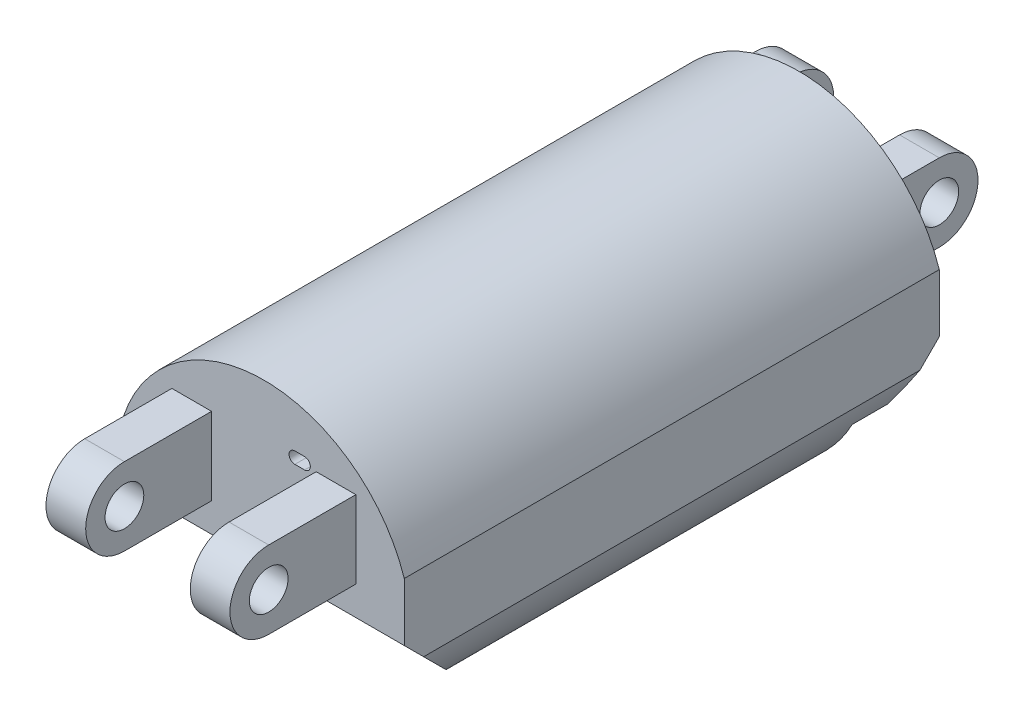
from build123d import *

# Parameters (mm, degrees)
BOSS_EXTRUDE1_DEPTH      = 17.541875
CUT_EXTRUDE1_DEPTH       = 29.014877472
CUT_EXTRUDE2_DEPTH       = 42.327781156
CUT_EXTRUDE2_DEPTH_BACK  = 42.327781156
SKETCH4_R                = 1.27
BOSS_EXTRUDE2_DEPTH      = 0.635
SKETCH5_R                = 1.27
BOSS_EXTRUDE3_DEPTH      = 1.332294919
MIRROR2_COPY_1_SKETCH_R  = 1.27
MIRROR2_COPY_1_DEPTH     = 0.635
MIRROR2_COPY_2_SKETCH_R  = 1.27
MIRROR2_COPY_2_DEPTH     = 1.332294919
SKETCH10_R               = 1.27
BOSS_EXTRUDE6_DEPTH      = 2.602294919
BOSS_EXTRUDE7_START      = -2.602294919
BOSS_EXTRUDE7_DEPTH      = 2.602294919
SKETCH11_R               = 1.27
CUT_EXTRUDE5_DEPTH       = 12.065
SKETCH20_W               = 2.54
SKETCH20_H               = 12.7
CUT_EXTRUDE9_DEPTH       = 5.08
CUT_EXTRUDE10_DEPTH      = 10.16
CUT_EXTRUDE10_DEPTH_BACK = 15.875
FILLET1_R                = 0.635
SKETCH22_W               = 0.284935898
SKETCH22_H               = 2.320192308
CUT_EXTRUDE11_DEPTH      = 1
CUT_EXTRUDE12_DEPTH      = 17.78


with BuildPart() as part:
    # Sketch1 → Boss-Extrude1 (new, symmetric)
    with BuildSketch(Plane.XY):
        with BuildLine():
            Line((0, 0), (0, 5.08))
            ThreePointArc((0, 5.08), (9.2075, 11.7475), (18.415, 5.08))
            Line((18.415, 5.08), (18.415, 0))
            ThreePointArc((18.415, 0), (9.2075, -6.6675), (0, 0))
        make_face()
    extrude(amount=BOSS_EXTRUDE1_DEPTH, both=True)

    # Sketch2 → Cut-Extrude1 (cut, through all)
    with BuildSketch(Plane(origin=(0, 0, 0), x_dir=(0, 0, -1), z_dir=(1, 0, 0))):
        Polygon((-17.541875, 1.27), (-17.541875, -6.6675), (-9.604375, -6.6675), align=None)
        Polygon((17.541875, -6.6675), (9.604375, -6.6675), (17.541875, 1.27), align=None)
    extrude(amount=CUT_EXTRUDE1_DEPTH, mode=Mode.SUBTRACT)

    # Sketch3 → Cut-Extrude2 (cut, two sides: drawn at the far end of the back side and taken through both)
    with BuildSketch(Plane.XY.offset(17.541875).offset(-CUT_EXTRUDE2_DEPTH_BACK)):
        with BuildLine():
            ThreePointArc((6.08942364, -4.798981149), (9.2075, -5.3975), (12.32557636, -4.798981149))
            ThreePointArc((12.32557636, -4.798981149), (9.2075, -2.2225), (6.08942364, -4.798981149))
        make_face()
    extrude(amount=CUT_EXTRUDE2_DEPTH + CUT_EXTRUDE2_DEPTH_BACK, mode=Mode.SUBTRACT)

    # Sketch4 → Boss-Extrude2 (add, symmetric)
    with BuildSketch(Plane(origin=(14.605, 0, 0), x_dir=(0, 0, -1), z_dir=(1, 0, 0))):
        with BuildLine():
            Line((-17.541875, 8.255), (-20.716875, 8.255))
            ThreePointArc((-20.716875, 8.255), (-23.256875, 5.715), (-20.716875, 3.175))
            Line((-20.716875, 3.175), (-17.541875, 3.175))
            Line((-17.541875, 3.175), (-17.541875, 8.255))
        make_face()
        with Locations((-20.716875, 5.715)):
            Circle(SKETCH4_R, mode=Mode.SUBTRACT)
    boss_extrude2 = extrude(amount=BOSS_EXTRUDE2_DEPTH, both=True)

    # Sketch5 → Boss-Extrude3 (add)
    with BuildSketch(Plane.ZY.offset(-13.97)):
        with BuildLine():
            Line((17.541875, 8.255), (17.541875, 3.175))
            Line((17.541875, 3.175), (20.716875, 3.175))
            ThreePointArc((20.716875, 3.175), (23.256875, 5.715), (20.716875, 8.255))
            Line((20.716875, 8.255), (17.541875, 8.255))
        make_face()
        with Locations((20.716875, 5.715)):
            Circle(SKETCH5_R, mode=Mode.SUBTRACT)
    boss_extrude3 = extrude(amount=BOSS_EXTRUDE3_DEPTH)

    # Mirror1: Boss-Extrude2, Boss-Extrude3 across plane
    add(boss_extrude2.mirror(Plane(origin=(9.2075, 0, 0), x_dir=(0, 0, 1), z_dir=(1, 0, 0))))
    add(boss_extrude3.mirror(Plane(origin=(9.2075, 0, 0), x_dir=(0, 0, 1), z_dir=(1, 0, 0))))

    # Mirror2: Boss-Extrude2, Boss-Extrude3 across plane
    add(boss_extrude2.mirror(Plane.XY))
    add(boss_extrude3.mirror(Plane.XY))

    # Mirror2 copy 1 sketch → Mirror2 copy 1 (add, symmetric)
    with BuildSketch(Plane.ZY.offset(-3.81)):
        with BuildLine():
            Line((-17.541875, 8.255), (-20.716875, 8.255))
            ThreePointArc((-20.716875, 8.255), (-23.256875, 5.715), (-20.716875, 3.175))
            Line((-20.716875, 3.175), (-17.541875, 3.175))
            Line((-17.541875, 3.175), (-17.541875, 8.255))
        make_face()
        with Locations((-20.716875, 5.715)):
            Circle(MIRROR2_COPY_1_SKETCH_R, mode=Mode.SUBTRACT)
    extrude(amount=MIRROR2_COPY_1_DEPTH, both=True)

    # Mirror2 copy 2 sketch → Mirror2 copy 2 (add)
    with BuildSketch(Plane(origin=(4.445, 0, 0), x_dir=(0, 0, -1), z_dir=(1, 0, 0))):
        with BuildLine():
            Line((17.541875, 8.255), (17.541875, 3.175))
            Line((17.541875, 3.175), (20.716875, 3.175))
            ThreePointArc((20.716875, 3.175), (23.256875, 5.715), (20.716875, 8.255))
            Line((20.716875, 8.255), (17.541875, 8.255))
        make_face()
        with Locations((20.716875, 5.715)):
            Circle(MIRROR2_COPY_2_SKETCH_R, mode=Mode.SUBTRACT)
    extrude(amount=MIRROR2_COPY_2_DEPTH)

    # Sketch10 → Boss-Extrude6 (add)
    with BuildSketch(Plane(origin=(15.24, 0, 0), x_dir=(0, 0, -1), z_dir=(1, 0, 0))):
        with BuildLine():
            Line((-17.541875, 8.255), (-23.256875, 8.255))
            ThreePointArc((-23.256875, 8.255), (-25.796875, 5.715), (-23.256875, 3.175))
            Line((-23.256875, 3.175), (-17.541875, 3.175))
            Line((-17.541875, 3.175), (-17.541875, 8.255))
        make_face()
        with Locations((-23.256875, 5.715)):
            Circle(SKETCH10_R, mode=Mode.SUBTRACT)
    extrude(amount=-BOSS_EXTRUDE6_DEPTH)

    # Sketch12 → Boss-Extrude7 (add)
    with BuildSketch(Plane.ZY.offset(-3.175).offset(BOSS_EXTRUDE7_START)):
        with BuildLine():
            Line((17.541875, 8.255), (23.256875, 8.255))
            ThreePointArc((23.256875, 8.255), (25.796875, 5.715), (23.256875, 3.175))
            Line((23.256875, 3.175), (17.541875, 3.175))
            Line((17.541875, 3.175), (17.541875, 8.255))
        make_face()
    extrude(amount=BOSS_EXTRUDE7_DEPTH)

    # Sketch11 → Cut-Extrude5 (cut)
    with BuildSketch(Plane(origin=(15.24, 0, 0), x_dir=(0, 0, -1), z_dir=(1, 0, 0))):
        with Locations((-23.256875, 5.715)):
            Circle(SKETCH11_R)
    extrude(amount=-CUT_EXTRUDE5_DEPTH, mode=Mode.SUBTRACT)

    # Sketch20 → Cut-Extrude9 (cut)
    with BuildSketch(Plane(origin=(0, 0, -17.541875), x_dir=(-1, 0, 0), z_dir=(0, 0, -1))):
        with Locations((-16.51, -0.635)):
            Rectangle(SKETCH20_W, SKETCH20_H)
        with Locations((-1.905, -0.635)):
            Rectangle(SKETCH20_W, SKETCH20_H)
    extrude(amount=-CUT_EXTRUDE9_DEPTH, mode=Mode.SUBTRACT)

    # Sketch21 → Cut-Extrude10 (cut, two sides: drawn at the far end of the back side and taken through both)
    with BuildSketch(Plane(origin=(0, 0, -17.541875), x_dir=(-1, 0, 0), z_dir=(0, 0, -1)).offset(-CUT_EXTRUDE10_DEPTH_BACK)):
        with BuildLine():
            Line((-7.1755, 7.7978), (-6.5405, 7.7978))
            Line((-6.5405, 7.7978), (-6.5405, 8.5598))
            Line((-6.5405, 8.5598), (-7.1755, 8.5598))
            ThreePointArc((-7.1755, 8.5598), (-7.5565, 8.1788), (-7.1755, 7.7978))
        make_face()
        with BuildLine():
            Line((-6.5405, 8.5598), (-6.5405, 7.7978))
            ThreePointArc((-6.5405, 7.7978), (-6.1595, 8.1788), (-6.5405, 8.5598))
        make_face()
    extrude(amount=CUT_EXTRUDE10_DEPTH + CUT_EXTRUDE10_DEPTH_BACK, mode=Mode.SUBTRACT)

    # Fillet1
    fillet1_edges = [part.edges().sort_by_distance(p)[0] for p in [
        (16.51, 5.715, -17.541875),
        (1.905, 5.715, -17.541875),
    ]]
    fillet(fillet1_edges, radius=FILLET1_R)

    # Sketch22 → Cut-Extrude11 (cut)
    # profile 1 of 9: a face of its own
    with BuildSketch(Plane.ZY):
        with BuildLine():
            Line((-8.211688554, 3.896834591), (-7.589027296, 3.896834591))
            add(Edge.make_bspline(
                [(-7.589027296, 3.896834591), (-7.546200259, 3.896787514), (-7.464141756, 3.896697312), (-7.34647167, 3.893962506), (-7.239601413, 3.890309721), (-7.143761425, 3.885246147), (-7.058656821, 3.879262097), (-6.9846727, 3.870869176), (-6.921227531, 3.862105908), (-6.883212394, 3.853196489), (-6.865875252, 3.849133269)],
                knots=[0, 0, 0, 0, 1.415646017, 2.712440637, 3.8905458, 4.950247383, 5.884950622, 6.709939814, 7.411656543, 8, 8, 8, 8], degree=3))
            add(Edge.make_bspline(
                [(-6.865875252, 3.849133269), (-6.843928261, 3.843126214), (-6.800551432, 3.831253654), (-6.738048343, 3.807474062), (-6.67858164, 3.779278098), (-6.621947298, 3.747143524), (-6.568841265, 3.709691619), (-6.518471214, 3.668440552), (-6.47128166, 3.622437915), (-6.427537969, 3.572199672), (-6.387365331, 3.518569196), (-6.352776262, 3.460745887), (-6.323813706, 3.399703062), (-6.298973167, 3.33548318), (-6.281094783, 3.267546958), (-6.267626524, 3.19636644), (-6.259077947, 3.121949257), (-6.258259195, 3.071094948), (-6.2578424, 3.045206987)],
                knots=[0, 0, 0, 0, 0.999701418, 1.975846123, 2.934577507, 3.890451536, 4.834027766, 5.787354733, 6.749476667, 7.726910423, 8.712836071, 9.690891519, 10.682875813, 11.679750201, 12.712814741, 13.765529915, 14.8625177, 16, 16, 16, 16], degree=3))
            add(Edge.make_bspline(
                [(-6.2578424, 3.045206987), (-6.258224692, 3.019101432), (-6.258972673, 2.968024151), (-6.267950018, 2.893300265), (-6.280042406, 2.82189144), (-6.29863616, 2.75395601), (-6.322989021, 2.689897418), (-6.351556812, 2.628736729), (-6.3860133, 2.571514455), (-6.425605396, 2.518022855), (-6.469648628, 2.468211721), (-6.51795665, 2.422442014), (-6.570334437, 2.38098165), (-6.626615528, 2.343737681), (-6.687348605, 2.311573771), (-6.751612559, 2.282765358), (-6.81996597, 2.258570896), (-6.867266679, 2.245843626), (-6.891315957, 2.239372652)],
                knots=[0, 0, 0, 0, 1.121902311, 2.195077645, 3.232258892, 4.234102512, 5.217864754, 6.176164875, 7.132989551, 8.084763148, 9.034132444, 9.988522005, 10.94243251, 11.903244335, 12.886203696, 13.894208494, 14.929344452, 16, 16, 16, 16], degree=3))
            add(Edge.make_bspline(
                [(-6.891315957, 2.239372652), (-6.911207182, 2.235142662), (-6.954799957, 2.225872393), (-7.026593712, 2.215523293), (-7.11018274, 2.206689898), (-7.205452952, 2.200066723), (-7.31231883, 2.194396746), (-7.430838184, 2.189889975), (-7.561243669, 2.187413608), (-7.652204012, 2.187285889), (-7.699694363, 2.187219206)],
                knots=[0, 0, 0, 0, 0.601384939, 1.31797006, 2.144135048, 3.087295005, 4.142315834, 5.309527816, 6.595305764, 8, 8, 8, 8], degree=3))
            Line((-7.699694363, 2.187219206), (-7.926752656, 2.187219206))
            Line((-7.926752656, 2.187219206), (-7.926752656, 0.721834591))
            Line((-7.926752656, 0.721834591), (-8.211688554, 0.721834591))
            Line((-8.211688554, 0.721834591), (-8.211688554, 3.896834591))
        make_face()
        with BuildLine():
            Line((-7.926752656, 3.571193565), (-7.926752656, 2.512860232))
            Line((-7.926752656, 2.512860232), (-7.370873249, 2.505864038))
            add(Edge.make_bspline(
                [(-7.370873249, 2.505864038), (-7.343731602, 2.505850011), (-7.291335212, 2.50582293), (-7.215646638, 2.509438097), (-7.145425356, 2.513611438), (-7.080887063, 2.519721883), (-7.022002665, 2.528359023), (-6.968673978, 2.537078243), (-6.921314514, 2.549692393), (-6.86588881, 2.566676891), (-6.804127488, 2.595644336), (-6.73693764, 2.637690307), (-6.679995751, 2.69128495), (-6.630721296, 2.751544483), (-6.591618107, 2.81858155), (-6.562992314, 2.890308371), (-6.546172835, 2.965989349), (-6.543917502, 3.017776446), (-6.542778297, 3.043934952)],
                knots=[0, 0, 0, 0, 1.160613943, 2.240541288, 3.23993089, 4.169200891, 5.011653406, 5.7853311, 6.478053781, 7.106038997, 8.262395093, 9.384106736, 10.481365981, 11.59014053, 12.70357646, 13.786202915, 14.881775077, 16, 16, 16, 16], degree=3))
            add(Edge.make_bspline(
                [(-6.542778297, 3.043934952), (-6.543923698, 3.069460603), (-6.546200613, 3.120202439), (-6.563124146, 3.194568886), (-6.591562452, 3.265539847), (-6.630983791, 3.33173686), (-6.678827531, 3.391779561), (-6.734434792, 3.443937669), (-6.797674679, 3.485867356), (-6.856501289, 3.512930404), (-6.908753793, 3.529454261), (-6.954139928, 3.541015652), (-7.00538504, 3.550246381), (-7.062505811, 3.557720787), (-7.125059511, 3.564119284), (-7.193583553, 3.568460849), (-7.267818358, 3.57100217), (-7.319353662, 3.571128222), (-7.346068562, 3.571193565)],
                knots=[0, 0, 0, 0, 1.120700087, 2.227813068, 3.331159281, 4.466773991, 5.599788987, 6.693661531, 7.80175334, 8.91857717, 9.525282508, 10.207424825, 10.974604443, 11.810962634, 12.737642355, 13.736264703, 14.826523623, 16, 16, 16, 16], degree=3))
            Line((-7.346068562, 3.571193565), (-7.926752656, 3.571193565))
        make_face(mode=Mode.SUBTRACT)
    # profile 2 of 9: a face of its own
    with BuildSketch(Plane.ZY):
        with BuildLine():
            add(Edge.make_bspline(
                [(-4.567307544, 3.082732027), (-4.523772604, 3.081805026), (-4.438411225, 3.079987403), (-4.313399786, 3.06056097), (-4.194069555, 3.030854432), (-4.079963509, 2.989786658), (-3.972543013, 2.93473946), (-3.870243384, 2.869053889), (-3.773345098, 2.791236822), (-3.715267064, 2.731040574), (-3.685787111, 2.700485432)],
                knots=[0, 0, 0, 0, 1.054011418, 2.066658804, 3.057071809, 4.030435133, 4.997543892, 5.974964718, 6.972108034, 8, 8, 8, 8], degree=3))
            add(Edge.make_bspline(
                [(-3.685787111, 2.700485432), (-3.660403482, 2.671262745), (-3.610127465, 2.613382911), (-3.545660706, 2.51953389), (-3.490124005, 2.422342513), (-3.44561689, 2.320518153), (-3.410524047, 2.214949701), (-3.385608737, 2.105274305), (-3.370788803, 1.991734176), (-3.368790398, 1.914623551), (-3.367778297, 1.875570569)],
                knots=[0, 0, 0, 0, 1.025258237, 2.030674902, 3.01204498, 3.988269485, 4.97094183, 5.956517959, 6.965070386, 8, 8, 8, 8], degree=3))
            add(Edge.make_bspline(
                [(-3.367778297, 1.875570569), (-3.36866851, 1.836291231), (-3.370427613, 1.758673427), (-3.387067894, 1.644355859), (-3.412949664, 1.533507699), (-3.449989975, 1.426593027), (-3.49748626, 1.323285033), (-3.55544424, 1.224034942), (-3.624270636, 1.128646935), (-3.702288547, 1.037930982), (-3.788514178, 0.954323059), (-3.882055255, 0.881453843), (-3.981073557, 0.819022888), (-4.086885742, 0.76873414), (-4.198525534, 0.729083198), (-4.316233731, 0.701233897), (-4.439827473, 0.684395798), (-4.524216453, 0.682233557), (-4.567307544, 0.681129463)],
                knots=[0, 0, 0, 0, 0.998656419, 1.973391657, 2.932242238, 3.890759089, 4.846373663, 5.82037756, 6.809684879, 7.83454468, 8.860553229, 9.859544525, 10.845671541, 11.83227036, 12.833544569, 13.85385346, 14.904124723, 16, 16, 16, 16], degree=3))
            add(Edge.make_bspline(
                [(-4.567307544, 0.681129463), (-4.610609754, 0.682237262), (-4.695419319, 0.684406943), (-4.819449317, 0.701168479), (-4.937368472, 0.729070363), (-5.049154415, 0.768864445), (-5.155421526, 0.819024496), (-5.255013562, 0.8812651), (-5.348630628, 0.954344669), (-5.4348745, 1.037925126), (-5.512887521, 1.128648444), (-5.581715178, 1.22403455), (-5.639672831, 1.323285135), (-5.687169202, 1.426592999), (-5.724209489, 1.533507706), (-5.750091266, 1.644355857), (-5.766731545, 1.758673427), (-5.768490648, 1.836291231), (-5.769380861, 1.875570569)],
                knots=[0, 0, 0, 0, 1.099876186, 2.154163076, 3.173186993, 4.173200201, 5.163417411, 6.152872554, 7.150605724, 8.17532212, 9.198891216, 10.186952605, 11.159729845, 12.11414092, 13.071450619, 14.029093627, 15.002601286, 16, 16, 16, 16], degree=3))
            add(Edge.make_bspline(
                [(-5.769380861, 1.875570569), (-5.768361858, 1.914411292), (-5.766344408, 1.99130925), (-5.751539374, 2.104635941), (-5.726721255, 2.214125715), (-5.691586346, 2.319286683), (-5.646668994, 2.420664828), (-5.591912683, 2.518096354), (-5.526788323, 2.611521001), (-5.476712267, 2.669326031), (-5.451372047, 2.69857738)],
                knots=[0, 0, 0, 0, 1.031353054, 2.041901799, 3.029428768, 4.008703097, 4.981709435, 5.96992636, 6.972712378, 8, 8, 8, 8], degree=3))
            add(Edge.make_bspline(
                [(-5.451372047, 2.69857738), (-5.42193654, 2.729397503), (-5.364046435, 2.790010699), (-5.266665803, 2.867600917), (-5.164617837, 2.934653356), (-5.056010225, 2.98860678), (-4.941997918, 3.031096006), (-4.822056177, 3.060637581), (-4.696620531, 3.07991741), (-4.610841446, 3.081784471), (-4.567307544, 3.082732027)],
                knots=[0, 0, 0, 0, 1.027980169, 2.021703884, 2.998553061, 3.971491411, 4.943284454, 5.930300938, 6.949603206, 8, 8, 8, 8], degree=3))
        make_face()
        with BuildLine():
            add(Edge.make_bspline(
                [(-4.568579579, 2.79779613), (-4.599365841, 2.796921107), (-4.660143622, 2.795193651), (-4.749605674, 2.78205468), (-4.835729956, 2.761238016), (-4.918679865, 2.731661479), (-4.998175671, 2.693471763), (-5.074293486, 2.646564894), (-5.1472572, 2.59156214), (-5.2156395, 2.528549574), (-5.27839774, 2.459716486), (-5.333259905, 2.386375475), (-5.379909823, 2.309716147), (-5.418771967, 2.229658784), (-5.447716345, 2.145392094), (-5.468737586, 2.057870378), (-5.481864162, 1.966915322), (-5.483575377, 1.905083541), (-5.484444964, 1.873662516)],
                knots=[0, 0, 0, 0, 1.021534396, 2.016698045, 2.994645724, 3.958388632, 4.93408049, 5.916473867, 6.921342795, 7.962252576, 8.998418191, 10.008913653, 10.997312074, 11.973003931, 12.956656626, 13.948281152, 14.957379055, 16, 16, 16, 16], degree=3))
            add(Edge.make_bspline(
                [(-5.484444964, 1.873662516), (-5.482987345, 1.833066034), (-5.480094245, 1.752489609), (-5.45656728, 1.633825233), (-5.417209727, 1.519904553), (-5.364062694, 1.411395403), (-5.297472767, 1.310999837), (-5.219016643, 1.221490704), (-5.129536343, 1.144215004), (-5.030098518, 1.08009738), (-4.922734244, 1.029152459), (-4.809108867, 0.993049102), (-4.690599094, 0.969579781), (-4.609608717, 0.967247086), (-4.568579579, 0.96606536)],
                knots=[0, 0, 0, 0, 1.016792936, 2.018143844, 3.017858371, 4.030088057, 5.03801393, 6.028138512, 7.003788237, 7.991172063, 8.984598303, 9.972568034, 10.972917682, 12, 12, 12, 12], degree=3))
            add(Edge.make_bspline(
                [(-4.568579579, 0.96606536), (-4.527552802, 0.967253972), (-4.446567082, 0.969600258), (-4.328221972, 0.992930901), (-4.214907155, 1.029310651), (-4.107654396, 1.080040084), (-4.008261834, 1.144458489), (-3.918137989, 1.221054345), (-3.840351748, 1.31123691), (-3.773827693, 1.411528383), (-3.71981029, 1.519736331), (-3.680636957, 1.633846259), (-3.657053433, 1.752484254), (-3.654167967, 1.83306424), (-3.652714195, 1.873662516)],
                knots=[0, 0, 0, 0, 1.02726834, 2.027799167, 3.010890988, 4.004497153, 4.992059811, 5.971914811, 6.958719428, 7.966827853, 8.981595046, 9.981490638, 10.983022906, 12, 12, 12, 12], degree=3))
            add(Edge.make_bspline(
                [(-3.652714195, 1.873662516), (-3.653583482, 1.905083729), (-3.655294108, 1.966915879), (-3.668424969, 2.057868248), (-3.689430351, 2.145399911), (-3.718433175, 2.229629942), (-3.757126459, 2.309923428), (-3.804675979, 2.386150395), (-3.859314123, 2.459970547), (-3.922829654, 2.528327064), (-3.991140576, 2.591586705), (-4.06413386, 2.646586222), (-4.140138805, 2.693265612), (-4.219403662, 2.731988131), (-4.302364206, 2.760968932), (-4.388367816, 2.782174876), (-4.477448165, 2.795138126), (-4.538008154, 2.796904462), (-4.568579579, 2.79779613)],
                knots=[0, 0, 0, 0, 1.042956736, 2.052379634, 3.044323526, 4.02829302, 5.004299113, 5.996692471, 7.007513377, 8.048758398, 9.090003419, 10.095195979, 11.07790575, 12.047570684, 13.018257071, 13.989683339, 14.985167495, 16, 16, 16, 16], degree=3))
        make_face(mode=Mode.SUBTRACT)
    # profile 3 of 9: a face of its own
    with BuildSketch(Plane.ZY):
        with BuildLine():
            add(Edge.make_bspline(
                [(-2.697415717, 4.018949976), (-2.679734309, 4.01812978), (-2.645110717, 4.01652368), (-2.595042538, 4.002770055), (-2.549452249, 3.979456769), (-2.509013877, 3.948178772), (-2.474313951, 3.911394634), (-2.450020021, 3.868522184), (-2.434405918, 3.822204705), (-2.432520372, 3.789896731), (-2.431560348, 3.773447171)],
                knots=[0, 0, 0, 0, 1.055194115, 2.066272739, 3.074728998, 4.095836921, 5.109056067, 6.073838105, 7.019297344, 8, 8, 8, 8], degree=3))
            add(Edge.make_bspline(
                [(-2.431560348, 3.773447171), (-2.432542022, 3.757424622), (-2.434482674, 3.725749937), (-2.45000796, 3.68023543), (-2.47452099, 3.637958687), (-2.508991626, 3.601245972), (-2.549458145, 3.569985266), (-2.595040972, 3.546667396), (-2.645111129, 3.532914986), (-2.679734448, 3.531308718), (-2.697415717, 3.530488437)],
                knots=[0, 0, 0, 0, 0.96129708, 1.900370562, 2.859976407, 3.87933698, 4.906634145, 5.921202961, 6.938410037, 8, 8, 8, 8], degree=3))
            add(Edge.make_bspline(
                [(-2.697415717, 3.530488437), (-2.714894795, 3.531277398), (-2.748915537, 3.532813006), (-2.79823403, 3.546937237), (-2.843435588, 3.569993246), (-2.883952827, 3.601041285), (-2.917725931, 3.638184156), (-2.942307983, 3.68020963), (-2.957797413, 3.725756506), (-2.959742897, 3.757426828), (-2.960727015, 3.773447171)],
                knots=[0, 0, 0, 0, 1.054934014, 2.053291228, 3.073705704, 4.106921865, 5.123545215, 6.088680038, 7.033164197, 8, 8, 8, 8], degree=3))
            add(Edge.make_bspline(
                [(-2.960727015, 3.773447171), (-2.959764458, 3.789894442), (-2.957873935, 3.822197919), (-2.942296373, 3.868548414), (-2.91793069, 3.911167347), (-2.883930464, 3.948383336), (-2.84344154, 3.979448838), (-2.798232492, 4.002500228), (-2.748915943, 4.016625657), (-2.714894933, 4.0181611), (-2.697415717, 4.018949976)],
                knots=[0, 0, 0, 0, 0.98631895, 1.937192651, 2.907499808, 3.917963147, 4.944918757, 5.95915025, 6.951458133, 8, 8, 8, 8], degree=3))
        make_face()
    # profile 4 of 9: a face of its own
    with BuildSketch(Plane.ZY):
        with Locations((-2.696143682, 1.881930745)):
            Rectangle(SKETCH22_W, SKETCH22_H)
    # profile 5 of 9: a face of its own
    with BuildSketch(Plane.ZY):
        with BuildLine():
            Line((-1.861688554, 3.042026899), (-1.576752656, 3.042026899))
            Line((-1.576752656, 3.042026899), (-1.576752656, 2.623527299))
            add(Edge.make_bspline(
                [(-1.576752656, 2.623527299), (-1.54632923, 2.661484627), (-1.48729151, 2.735142144), (-1.388971436, 2.831952951), (-1.285063755, 2.911731834), (-1.176204795, 2.97532599), (-1.062246779, 3.023265429), (-0.943884348, 3.057887381), (-0.820408865, 3.07864719), (-0.736439697, 3.081359756), (-0.693960188, 3.082732027)],
                knots=[0, 0, 0, 0, 1.12780773, 2.188550248, 3.19190651, 4.159438251, 5.104880172, 6.052711206, 7.014878035, 8, 8, 8, 8], degree=3))
            add(Edge.make_bspline(
                [(-0.693960188, 3.082732027), (-0.651024542, 3.081148885), (-0.566989124, 3.078050295), (-0.444635454, 3.053542297), (-0.33035959, 3.011681959), (-0.224568993, 2.95433958), (-0.129203592, 2.883032279), (-0.045451763, 2.799958149), (0.023820612, 2.704403273), (0.070263934, 2.61575441), (0.100857914, 2.53711529), (0.120118677, 2.469762881), (0.136475353, 2.394725701), (0.150655582, 2.312230502), (0.160250534, 2.221699287), (0.167818184, 2.123503166), (0.173241714, 2.017673948), (0.173456894, 1.94447965), (0.173567857, 1.906735432)],
                knots=[0, 0, 0, 0, 1.235846778, 2.418850247, 3.575807741, 4.728682307, 5.871620074, 6.994088408, 8.11269785, 9.256955736, 9.865816715, 10.540099792, 11.271859618, 12.076849838, 12.949306005, 13.892391288, 14.913166135, 16, 16, 16, 16], degree=3))
            Line((0.173567857, 1.906735432), (0.173567857, 0.721834591))
            Line((0.173567857, 0.721834591), (-0.111368041, 0.721834591))
            Line((-0.111368041, 0.721834591), (-0.111368041, 1.813240841))
            add(Edge.make_bspline(
                [(-0.111368041, 1.813240841), (-0.111543308, 1.844829773), (-0.111878565, 1.905254024), (-0.112935973, 1.991767353), (-0.115484869, 2.070223034), (-0.119066552, 2.140433504), (-0.124308959, 2.202331341), (-0.129772346, 2.256042613), (-0.136453432, 2.301499127), (-0.142406932, 2.328863166), (-0.145076975, 2.341135473)],
                knots=[0, 0, 0, 0, 1.430800155, 2.736877192, 3.918605307, 4.986035426, 5.920637409, 6.731861385, 7.431261377, 8, 8, 8, 8], degree=3))
            add(Edge.make_bspline(
                [(-0.145076975, 2.341135473), (-0.15471585, 2.37715919), (-0.173267702, 2.446493701), (-0.219109244, 2.54054115), (-0.276997822, 2.620549506), (-0.3476623, 2.686024103), (-0.430420104, 2.736979077), (-0.525041584, 2.772334021), (-0.630613636, 2.79444678), (-0.704867255, 2.796648535), (-0.743569563, 2.79779613)],
                knots=[0, 0, 0, 0, 1.084156227, 2.086665306, 3.027808233, 3.945421172, 4.874247719, 5.839848303, 6.874090471, 8, 8, 8, 8], degree=3))
            add(Edge.make_bspline(
                [(-0.743569563, 2.79779613), (-0.766490962, 2.797364325), (-0.811851818, 2.796509796), (-0.879116435, 2.787936118), (-0.944361935, 2.773913091), (-1.008243125, 2.754982255), (-1.069482337, 2.728981483), (-1.130047087, 2.699472697), (-1.187656795, 2.662689676), (-1.243539876, 2.621695326), (-1.295530781, 2.576266331), (-1.343907202, 2.528328811), (-1.387030977, 2.477278799), (-1.426100419, 2.423938847), (-1.459826415, 2.367576394), (-1.489266002, 2.308735202), (-1.51424481, 2.247337824), (-1.526656967, 2.204724733), (-1.53286744, 2.183403101)],
                knots=[0, 0, 0, 0, 1.023777757, 2.026029729, 3.023749952, 4.003683103, 4.997618607, 5.993177895, 7.010360494, 8.046726602, 9.087585522, 10.09234134, 11.086953743, 12.070360549, 13.043493632, 14.017870808, 15.008233677, 16, 16, 16, 16], degree=3))
            add(Edge.make_bspline(
                [(-1.53286744, 2.183403101), (-1.536441264, 2.167750167), (-1.544221292, 2.133674548), (-1.552624319, 2.077754253), (-1.560251191, 2.013065918), (-1.566634718, 1.939685031), (-1.570540346, 1.857354673), (-1.574798834, 1.766426448), (-1.576349197, 1.666537784), (-1.576614404, 1.596994677), (-1.576752656, 1.560741843)],
                knots=[0, 0, 0, 0, 0.615963638, 1.340920617, 2.168419149, 3.115676021, 4.16674242, 5.331190069, 6.6087489, 8, 8, 8, 8], degree=3))
            Line((-1.576752656, 1.560741843), (-1.576752656, 0.721834591))
            Line((-1.576752656, 0.721834591), (-1.861688554, 0.721834591))
            Line((-1.861688554, 0.721834591), (-1.861688554, 3.042026899))
        make_face()
    # profile 6 of 9: a face of its own
    with BuildSketch(Plane.ZY):
        Polygon((1.109785805, 3.978244848), (1.394721703, 3.978244848), (1.394721703, 3.042026899), (1.801772985, 3.042026899), (1.801772985, 2.757091001), (1.394721703, 2.757091001), (1.394721703, 0.721834591), (1.109785805, 0.721834591), (1.109785805, 2.757091001), (0.702734523, 2.757091001), (0.702734523, 3.042026899), (1.109785805, 3.042026899), align=None)
    # profile 7 of 9: a face of its own
    with BuildSketch(Plane.ZY):
        with BuildLine():
            Line((4.194471302, 1.454526899), (4.447606318, 1.321599214))
            add(Edge.make_bspline(
                [(4.447606318, 1.321599214), (4.42743455, 1.285818478), (4.388188276, 1.216203335), (4.320696169, 1.120561576), (4.249946218, 1.034521148), (4.172744761, 0.960380676), (4.091401552, 0.895745491), (4.005465501, 0.839196178), (3.914489216, 0.791010092), (3.818468395, 0.750413156), (3.716596659, 0.719198829), (3.608627141, 0.697151429), (3.494352998, 0.683523178), (3.416024678, 0.681940086), (3.375916615, 0.681129463)],
                knots=[0, 0, 0, 0, 1.120438281, 2.179929193, 3.190490725, 4.156257408, 5.095198341, 6.022838206, 6.959905092, 7.901321166, 8.864066838, 9.862729781, 10.905609505, 12, 12, 12, 12], degree=3))
            add(Edge.make_bspline(
                [(3.375916615, 0.681129463), (3.331337821, 0.682170115), (3.244377508, 0.684200125), (3.117795024, 0.701701146), (2.998615123, 0.730251072), (2.886844506, 0.770134099), (2.782756891, 0.822228886), (2.686145401, 0.88569213), (2.596501974, 0.960197818), (2.516651442, 1.046391306), (2.44476592, 1.138631367), (2.381333211, 1.234748491), (2.32830397, 1.334500845), (2.28516696, 1.437253392), (2.250328261, 1.542358495), (2.226047037, 1.650772469), (2.212050051, 1.762201892), (2.209905161, 1.837583047), (2.208824267, 1.875570569)],
                knots=[0, 0, 0, 0, 1.145258523, 2.234067595, 3.276747158, 4.290159414, 5.277019952, 6.260822364, 7.254936242, 8.264827045, 9.274100331, 10.257902744, 11.220704747, 12.172965371, 13.118907548, 14.062713208, 15.023725156, 16, 16, 16, 16], degree=3))
            add(Edge.make_bspline(
                [(2.208824267, 1.875570569), (2.209785059, 1.911216593), (2.211689223, 1.981862307), (2.223691438, 2.086424622), (2.244962389, 2.188050433), (2.274150912, 2.286824182), (2.311843828, 2.382580489), (2.357955912, 2.475377633), (2.412558998, 2.565116867), (2.454716352, 2.621725424), (2.475951671, 2.65024004)],
                knots=[0, 0, 0, 0, 1.024358464, 2.0301432, 3.019427413, 4.004406732, 4.986367066, 5.972626655, 6.978780325, 8, 8, 8, 8], degree=3))
            add(Edge.make_bspline(
                [(2.475951671, 2.65024004), (2.504715069, 2.684592515), (2.561330713, 2.752209266), (2.657085407, 2.841053318), (2.760772014, 2.915478743), (2.871091132, 2.977170931), (2.989324933, 3.02404631), (3.113884076, 3.058978189), (3.246186857, 3.078552527), (3.336633736, 3.081317348), (3.382912809, 3.082732027)],
                knots=[0, 0, 0, 0, 1.030682036, 2.02871468, 2.997146059, 3.962720338, 4.930598197, 5.918074684, 6.934738563, 8, 8, 8, 8], degree=3))
            add(Edge.make_bspline(
                [(3.382912809, 3.082732027), (3.430490279, 3.081503711), (3.523826431, 3.079094036), (3.659926998, 3.056754433), (3.788705648, 3.021328187), (3.910110848, 2.97129582), (4.024154907, 2.906743941), (4.130096538, 2.826786699), (4.229747553, 2.733878863), (4.287721764, 2.66242938), (4.317222704, 2.62607137)],
                knots=[0, 0, 0, 0, 1.056321875, 2.072262726, 3.055038591, 4.01806755, 4.982017516, 5.957941055, 6.960871419, 8, 8, 8, 8], degree=3))
            add(Edge.make_bspline(
                [(4.317222704, 2.62607137), (4.337294998, 2.598672407), (4.377305979, 2.544056856), (4.427422992, 2.455001592), (4.4709272, 2.36182841), (4.505700672, 2.263031212), (4.533857933, 2.159780593), (4.554229476, 2.051338428), (4.566176202, 1.937737008), (4.56852452, 1.860333633), (4.569721703, 1.820873053)],
                knots=[0, 0, 0, 0, 0.94817472, 1.890038105, 2.849395472, 3.817997239, 4.812318967, 5.836947057, 6.897266129, 8, 8, 8, 8], degree=3))
            Line((4.569721703, 1.820873053), (2.493760164, 1.820873053))
            add(Edge.make_bspline(
                [(2.493760164, 1.820873053), (2.495156807, 1.790301917), (2.497903249, 1.730185012), (2.510707701, 1.642218659), (2.530890517, 1.558422842), (2.559256024, 1.479426082), (2.593606662, 1.404196609), (2.635685134, 1.333292476), (2.685886015, 1.267036639), (2.741880042, 1.20483645), (2.804207193, 1.149445617), (2.869777971, 1.099868648), (2.939531419, 1.058316428), (3.012917537, 1.024588957), (3.089817657, 0.99818537), (3.170256005, 0.980162419), (3.254074297, 0.968090972), (3.311211355, 0.966748704), (3.340299628, 0.96606536)],
                knots=[0, 0, 0, 0, 1.094153842, 2.151609401, 3.174256925, 4.172055639, 5.149267565, 6.128595816, 7.11444997, 8.118368179, 9.117203808, 10.09244225, 11.054858984, 12.015122123, 12.976791628, 13.957293641, 14.960065497, 16, 16, 16, 16], degree=3))
            add(Edge.make_bspline(
                [(3.340299628, 0.96606536), (3.368739597, 0.966616955), (3.425169952, 0.967711423), (3.509208444, 0.978353943), (3.591885016, 0.995562693), (3.672857479, 1.019048612), (3.750482461, 1.047693328), (3.822369496, 1.082258063), (3.888482263, 1.120493905), (3.950274082, 1.164226967), (4.010209912, 1.217755823), (4.06966631, 1.284553941), (4.133417274, 1.36355477), (4.173322119, 1.423014052), (4.194471302, 1.454526899)],
                knots=[0, 0, 0, 0, 0.99110716, 1.966546729, 2.947904876, 3.932708344, 4.903319531, 5.828989031, 6.710028674, 7.56322171, 8.463672341, 9.504779593, 10.677557249, 12, 12, 12, 12], degree=3))
        make_face()
        with BuildLine():
            add(Edge.make_bspline(
                [(4.284785805, 2.10580895), (4.274356725, 2.143603128), (4.254284101, 2.216344756), (4.212341113, 2.317074706), (4.165104787, 2.406598731), (4.109205074, 2.484231684), (4.045869515, 2.553177727), (3.972712814, 2.613428873), (3.890674539, 2.667328989), (3.800178747, 2.712824471), (3.704346557, 2.751550271), (3.60401094, 2.77751734), (3.501632803, 2.795305997), (3.432386701, 2.796962538), (3.397541214, 2.79779613)],
                knots=[0, 0, 0, 0, 1.154881502, 2.222775134, 3.210006277, 4.132804581, 5.035138423, 5.962687519, 6.919655026, 7.923214229, 8.944639381, 9.960483929, 10.97369054, 12, 12, 12, 12], degree=3))
            add(Edge.make_bspline(
                [(3.397541214, 2.79779613), (3.369102795, 2.797241256), (3.312886019, 2.796144388), (3.230062907, 2.785739342), (3.150524894, 2.768540054), (3.073685098, 2.744986129), (3.000550453, 2.713591183), (2.929616627, 2.676776399), (2.862687268, 2.631835105), (2.820830521, 2.597582429), (2.799684644, 2.580278101)],
                knots=[0, 0, 0, 0, 1.04873581, 2.073130211, 3.073294108, 4.04793562, 5.032784715, 6.005352987, 6.992311501, 8, 8, 8, 8], degree=3))
            add(Edge.make_bspline(
                [(2.799684644, 2.580278101), (2.784541452, 2.5665854), (2.753895323, 2.538874711), (2.712946421, 2.491132502), (2.673739278, 2.439650728), (2.638058036, 2.382459794), (2.605330511, 2.320210944), (2.574705389, 2.253429232), (2.547140573, 2.181607893), (2.531631958, 2.131558609), (2.523652993, 2.10580895)],
                knots=[0, 0, 0, 0, 0.879870761, 1.780643979, 2.707998968, 3.669668524, 4.684282772, 5.740141944, 6.837334558, 8, 8, 8, 8], degree=3))
            Line((2.523652993, 2.10580895), (4.284785805, 2.10580895))
        make_face(mode=Mode.SUBTRACT)
    # profile 8 of 9: a face of its own
    with BuildSketch(Plane.ZY):
        with BuildLine():
            Line((5.058183241, 3.042026899), (5.343119139, 3.042026899))
            Line((5.343119139, 3.042026899), (5.343119139, 2.700485432))
            add(Edge.make_bspline(
                [(5.343119139, 2.700485432), (5.364154656, 2.732286077), (5.404384918, 2.793104562), (5.471253076, 2.873540285), (5.539745383, 2.94013822), (5.610189732, 2.993209269), (5.683104151, 3.032954027), (5.756888386, 3.062066994), (5.832703276, 3.07928213), (5.883650165, 3.081580521), (5.909174828, 3.082732027)],
                knots=[0, 0, 0, 0, 1.2804753, 2.448899062, 3.506932113, 4.484331642, 5.4025378, 6.288909075, 7.142734305, 8, 8, 8, 8], degree=3))
            add(Edge.make_bspline(
                [(5.909174828, 3.082732027), (5.928974424, 3.081652049), (5.96971338, 3.079429925), (6.031383301, 3.063817248), (6.094922718, 3.038890756), (6.135873312, 3.015449983), (6.157221703, 3.003229823)],
                knots=[0, 0, 0, 0, 0.901110191, 1.854092781, 2.881294221, 4, 4, 4, 4], degree=3))
            Line((6.157221703, 3.003229823), (6.000761366, 2.756454984))
            add(Edge.make_bspline(
                [(6.000761366, 2.756454984), (5.987055326, 2.762569368), (5.961038637, 2.77417564), (5.922979852, 2.787911606), (5.887890353, 2.795999616), (5.865535125, 2.797224909), (5.855113329, 2.79779613)],
                knots=[0, 0, 0, 0, 1.180555205, 2.24091978, 3.179933427, 4, 4, 4, 4], degree=3))
            add(Edge.make_bspline(
                [(5.855113329, 2.79779613), (5.832248128, 2.796272096), (5.785609746, 2.793163508), (5.717134522, 2.768726161), (5.650688842, 2.729242551), (5.597918834, 2.685453756), (5.557059076, 2.643228254), (5.5279033, 2.606354346), (5.501158237, 2.565008016), (5.475603823, 2.519896089), (5.452320827, 2.4702483), (5.43059052, 2.416560671), (5.410942837, 2.358771018), (5.399739402, 2.318509732), (5.394000549, 2.297886274)],
                knots=[0, 0, 0, 0, 1.125678352, 2.296057538, 3.5422874, 4.923748041, 5.663163013, 6.437101912, 7.23742474, 8.08941207, 8.991984279, 9.93940061, 10.944477711, 12, 12, 12, 12], degree=3))
            add(Edge.make_bspline(
                [(5.394000549, 2.297886274), (5.389707592, 2.279491981), (5.380199019, 2.238750019), (5.370953838, 2.170398143), (5.361819347, 2.089640967), (5.3553817, 1.9962537), (5.349414476, 1.890469555), (5.346048902, 1.772127376), (5.34323391, 1.641105693), (5.343158556, 1.54950753), (5.343119139, 1.501592203)],
                knots=[0, 0, 0, 0, 0.566838948, 1.255505196, 2.06880316, 3.007127437, 4.065329342, 5.249902469, 6.561414163, 8, 8, 8, 8], degree=3))
            Line((5.343119139, 1.501592203), (5.343119139, 0.721834591))
            Line((5.343119139, 0.721834591), (5.058183241, 0.721834591))
            Line((5.058183241, 0.721834591), (5.058183241, 3.042026899))
        make_face()
    # profile 9 of 9: a face of its own
    with BuildSketch(Plane.ZY):
        with BuildLine():
            Line((7.866837087, 3.164142283), (7.58190119, 3.164142283))
            add(Edge.make_bspline(
                [(7.58190119, 3.164142283), (7.589620568, 3.19610318), (7.604711321, 3.258584117), (7.636186977, 3.347853561), (7.670476301, 3.432329898), (7.711650703, 3.510431337), (7.756562216, 3.583727484), (7.808017828, 3.650555904), (7.863643576, 3.712616237), (7.925170494, 3.767691817), (7.989694352, 3.817564471), (8.058124328, 3.860086845), (8.129083667, 3.896666612), (8.203064009, 3.926802108), (8.280285608, 3.949503833), (8.360050338, 3.96597465), (8.442567227, 3.976670875), (8.498581113, 3.977714781), (8.527023386, 3.978244848)],
                knots=[0, 0, 0, 0, 1.162005537, 2.271625781, 3.343758855, 4.383309926, 5.390229558, 6.379919256, 7.361854164, 8.333198761, 9.295911338, 10.242430842, 11.177959212, 12.116337295, 13.062827104, 14.020064771, 14.994644689, 16, 16, 16, 16], degree=3))
            add(Edge.make_bspline(
                [(8.527023386, 3.978244848), (8.568464159, 3.976993689), (8.650441761, 3.974518662), (8.770876811, 3.951917709), (8.887015426, 3.916153482), (8.997586386, 3.86673803), (9.100291679, 3.805789538), (9.191673791, 3.733250098), (9.270494083, 3.650519303), (9.336619697, 3.559140477), (9.388394875, 3.461481551), (9.426573228, 3.36096998), (9.449815753, 3.257844191), (9.452827972, 3.188214374), (9.454337087, 3.153329984)],
                knots=[0, 0, 0, 0, 1.083050992, 2.142477498, 3.193116406, 4.255571735, 5.30263384, 6.308962982, 7.297363603, 8.282367274, 9.249857812, 10.179914175, 11.08814088, 12, 12, 12, 12], degree=3))
            add(Edge.make_bspline(
                [(9.454337087, 3.153329984), (9.453281544, 3.119759534), (9.45121601, 3.054067374), (9.433677577, 2.958162873), (9.404162538, 2.867773707), (9.363277825, 2.782519367), (9.310353705, 2.702940405), (9.246243472, 2.628857776), (9.170494629, 2.559942897), (9.113091593, 2.520464518), (9.08353881, 2.50013988)],
                knots=[0, 0, 0, 0, 1.024540389, 2.004866551, 2.965041327, 3.920577974, 4.882998113, 5.874504559, 6.905732034, 8, 8, 8, 8], degree=3))
            add(Edge.make_bspline(
                [(9.08353881, 2.50013988), (9.11731333, 2.48383111), (9.184230424, 2.45151872), (9.275444118, 2.388149568), (9.358246191, 2.314982739), (9.404423136, 2.257884761), (9.427624347, 2.22919637)],
                knots=[0, 0, 0, 0, 1.015518401, 2.012035669, 3.001164323, 4, 4, 4, 4], degree=3))
            add(Edge.make_bspline(
                [(9.427624347, 2.22919637), (9.44290185, 2.208279695), (9.473206678, 2.166788871), (9.510613198, 2.100080827), (9.544548608, 2.032633405), (9.570992022, 1.962638801), (9.591469744, 1.890908281), (9.60610743, 1.817318679), (9.615200758, 1.741809902), (9.616503009, 1.690726438), (9.6171576, 1.665048734)],
                knots=[0, 0, 0, 0, 1.025084078, 2.033381695, 3.024893161, 4.013698104, 4.991890475, 5.976764909, 6.982997093, 8, 8, 8, 8], degree=3))
            add(Edge.make_bspline(
                [(9.6171576, 1.665048734), (9.61552972, 1.620589915), (9.612281621, 1.531881502), (9.583249353, 1.40082229), (9.538243056, 1.272710585), (9.47432855, 1.150178409), (9.396434453, 1.035533349), (9.303763166, 0.932956983), (9.197367638, 0.844783963), (9.078708228, 0.771114685), (8.950150547, 0.712224856), (8.812649832, 0.671351318), (8.668187283, 0.644730304), (8.569120663, 0.641875645), (8.518755156, 0.640424335)],
                knots=[0, 0, 0, 0, 0.955779014, 1.907060117, 2.875433937, 3.871313158, 4.872415639, 5.851225146, 6.836215519, 7.83643374, 8.849228613, 9.86973379, 10.916971861, 12, 12, 12, 12], degree=3))
            add(Edge.make_bspline(
                [(8.518755156, 0.640424335), (8.484810505, 0.641211928), (8.418018751, 0.642761649), (8.319826435, 0.653355809), (8.226098894, 0.672705171), (8.136709401, 0.698743169), (8.051578547, 0.731755678), (7.970966108, 0.772866212), (7.894376134, 0.82122736), (7.822531371, 0.877409972), (7.755440384, 0.940258044), (7.694886127, 1.010887289), (7.63985903, 1.087992077), (7.591832493, 1.172467992), (7.548618972, 1.263223332), (7.513076247, 1.361420185), (7.481792909, 1.46618069), (7.467248267, 1.539185497), (7.459785805, 1.576642283)],
                knots=[0, 0, 0, 0, 1.048658725, 2.063410685, 3.046034179, 4.001477787, 4.936774919, 5.862367409, 6.792675028, 7.730719943, 8.675894397, 9.627829632, 10.600096036, 11.597688215, 12.626045268, 13.701542398, 14.82072376, 16, 16, 16, 16], degree=3))
            Line((7.459785805, 1.576642283), (7.744721703, 1.576642283))
            add(Edge.make_bspline(
                [(7.744721703, 1.576642283), (7.752145117, 1.552195679), (7.766584303, 1.504644909), (7.791162702, 1.436209774), (7.819164634, 1.37347354), (7.84920427, 1.315975994), (7.880753289, 1.263150886), (7.916054685, 1.216395047), (7.952493838, 1.173654828), (7.979961537, 1.149575073), (7.993404595, 1.13779012)],
                knots=[0, 0, 0, 0, 1.198163088, 2.33053128, 3.407730985, 4.417276592, 5.372219308, 6.28897303, 7.162600585, 8, 8, 8, 8], degree=3))
            add(Edge.make_bspline(
                [(7.993404595, 1.13779012), (8.01118149, 1.124084703), (8.046680405, 1.096716174), (8.104527301, 1.061789697), (8.165364733, 1.031526481), (8.230510902, 1.008409128), (8.298560015, 0.988835107), (8.370611982, 0.976025779), (8.446031129, 0.967237224), (8.4975276, 0.966461679), (8.523843297, 0.96606536)],
                knots=[0, 0, 0, 0, 0.946170439, 1.889420265, 2.845303464, 3.807233317, 4.801018734, 5.828864929, 6.890507805, 8, 8, 8, 8], degree=3))
            add(Edge.make_bspline(
                [(8.523843297, 0.96606536), (8.553555403, 0.966624074), (8.611654862, 0.967716591), (8.69643177, 0.97776384), (8.777083526, 0.992396429), (8.85271468, 1.014996064), (8.924315926, 1.042918693), (8.990883565, 1.077978318), (9.053291461, 1.119112458), (9.110740279, 1.165865838), (9.16239799, 1.217048194), (9.207881691, 1.27058148), (9.246548348, 1.326239983), (9.277739165, 1.384331707), (9.302368593, 1.444616093), (9.319135497, 1.507262317), (9.330793657, 1.571757694), (9.331743083, 1.615598973), (9.332221703, 1.637699976)],
                knots=[0, 0, 0, 0, 1.217147791, 2.380027433, 3.494444702, 4.572153297, 5.609568379, 6.639424714, 7.649109417, 8.668170816, 9.669597737, 10.625200337, 11.543417969, 12.441394052, 13.322311151, 14.205496177, 15.095365482, 16, 16, 16, 16], degree=3))
            add(Edge.make_bspline(
                [(9.332221703, 1.637699976), (9.330833501, 1.667283119), (9.328064004, 1.726302203), (9.306919793, 1.813131717), (9.272140966, 1.896791527), (9.223452331, 1.97585428), (9.164183491, 2.049129562), (9.094909611, 2.114508692), (9.015055433, 2.168456561), (8.941558837, 2.205729842), (8.876457588, 2.231163474), (8.820745061, 2.248104335), (8.758372999, 2.26244958), (8.690095668, 2.275795712), (8.615398608, 2.287154363), (8.534363139, 2.296626582), (8.446972841, 2.304205797), (8.386474426, 2.307590434), (8.355298626, 2.309334591)],
                knots=[0, 0, 0, 0, 1.07054697, 2.135767047, 3.216561865, 4.33974944, 5.486079747, 6.621378074, 7.775625952, 8.963672916, 9.598146892, 10.304877434, 11.070270905, 11.915000392, 12.823868403, 13.805723172, 14.86925407, 16, 16, 16, 16], degree=3))
            Line((8.355298626, 2.309334591), (8.355298626, 2.634975617))
            add(Edge.make_bspline(
                [(8.355298626, 2.634975617), (8.394578969, 2.635642189), (8.471519512, 2.636947839), (8.583909346, 2.652739392), (8.691381565, 2.674583961), (8.791554395, 2.7080441), (8.882857156, 2.746906369), (8.962068509, 2.792129445), (9.028078707, 2.842398539), (9.080566965, 2.898489549), (9.120054194, 2.958646771), (9.148925646, 3.021345453), (9.165980228, 3.087135137), (9.168256854, 3.132033871), (9.16940119, 3.154602019)],
                knots=[0, 0, 0, 0, 1.321986639, 2.589447074, 3.816329219, 5.01088745, 6.139805852, 7.153945165, 8.075214402, 8.924034688, 9.728124013, 10.488707548, 11.240355623, 12, 12, 12, 12], degree=3))
            add(Edge.make_bspline(
                [(9.16940119, 3.154602019), (9.16902526, 3.171182545), (9.168277365, 3.204168715), (9.158845549, 3.252360742), (9.144672312, 3.299079457), (9.125187129, 3.344126185), (9.099106591, 3.387188505), (9.067895446, 3.428633547), (9.030731527, 3.46822469), (8.9881453, 3.505127551), (8.942414591, 3.540296788), (8.892295152, 3.570154158), (8.839298166, 3.59568575), (8.783364958, 3.616740085), (8.724314012, 3.632578153), (8.662422778, 3.643949952), (8.597573236, 3.651059825), (8.553330308, 3.652083459), (8.530839491, 3.652603822)],
                knots=[0, 0, 0, 0, 0.884392785, 1.759457502, 2.611959086, 3.489218968, 4.37281399, 5.2945488, 6.255912374, 7.266815255, 8.301784654, 9.332968512, 10.37626691, 11.440494194, 12.520033166, 13.637162961, 14.798855837, 16, 16, 16, 16], degree=3))
            add(Edge.make_bspline(
                [(8.530839491, 3.652603822), (8.494688335, 3.651341658), (8.42407672, 3.648876358), (8.322281759, 3.627283624), (8.227649221, 3.592832077), (8.155314859, 3.551708552), (8.101899952, 3.511113516), (8.063730158, 3.475660208), (8.026246552, 3.436260432), (7.991915117, 3.390487478), (7.957195152, 3.341441175), (7.925586157, 3.286628264), (7.894870579, 3.227478563), (7.876362552, 3.185663238), (7.866837087, 3.164142283)],
                knots=[0, 0, 0, 0, 1.472543308, 2.876219568, 4.221790263, 5.565193594, 6.249813518, 6.953379497, 7.687249741, 8.463570142, 9.283606569, 10.136032583, 11.040678096, 12, 12, 12, 12], degree=3))
        make_face()
    extrude(amount=-CUT_EXTRUDE11_DEPTH, mode=Mode.SUBTRACT)

    # Sketch24 → Cut-Extrude12 (cut)
    with BuildSketch(Plane.XY.offset(17.541875)):
        with BuildLine():
            Line((11.8745, 8.7376), (11.2395, 8.7376))
            ThreePointArc((11.2395, 8.7376), (10.8585, 8.3566), (11.2395, 7.9756))
            Line((11.2395, 7.9756), (11.8745, 7.9756))
            Line((11.8745, 7.9756), (11.8745, 8.7376))
        make_face()
        with BuildLine():
            ThreePointArc((11.8745, 7.9756), (12.2555, 8.3566), (11.8745, 8.7376))
            Line((11.8745, 8.7376), (11.8745, 7.9756))
        make_face()
    extrude(amount=-CUT_EXTRUDE12_DEPTH, mode=Mode.SUBTRACT)


solid = part.part
